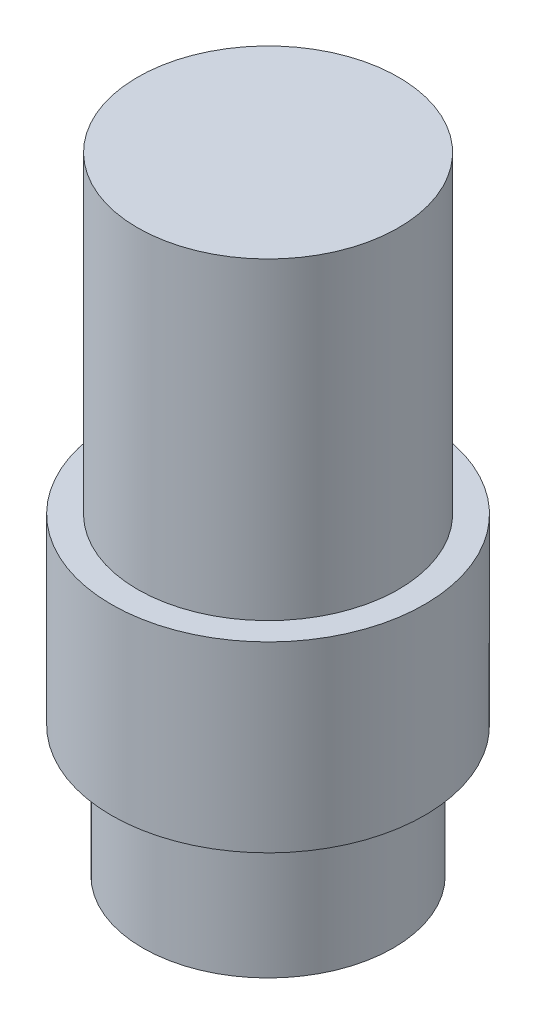
from build123d import *

# Parameters (mm, degrees)
SKETCH1_R           = 2.4
BOSS_EXTRUDE1_DEPTH = 2.5
SKETCH2_R           = 3
BOSS_EXTRUDE2_DEPTH = 3.5
SKETCH3_R           = 2.5
BOSS_EXTRUDE3_DEPTH = 6


with BuildPart() as part:
    # Sketch1 → Boss-Extrude1 (new body)
    with BuildSketch(Plane(origin=(0, 0, 0), x_dir=(1, 0, 0), z_dir=(0, 1, 0))):
        with Locations(Location((0, 0, 0), (0, 0, 270))):
            Circle(SKETCH1_R)
    extrude(amount=BOSS_EXTRUDE1_DEPTH)

    # Sketch2 → Boss-Extrude2 (add)
    with BuildSketch(Plane(origin=(0, 2.5, 0), x_dir=(1, 0, 0), z_dir=(0, 1, 0))):
        with Locations(Location((0, 0, 0), (0, 0, 270))):
            Circle(SKETCH2_R)
    extrude(amount=BOSS_EXTRUDE2_DEPTH)

    # Sketch3 → Boss-Extrude3 (add)
    with BuildSketch(Plane(origin=(0, 6, 0), x_dir=(1, 0, 0), z_dir=(0, 1, 0))):
        with Locations(Location((0, 0, 0), (0, 0, 270))):
            Circle(SKETCH3_R)
    extrude(amount=BOSS_EXTRUDE3_DEPTH)


solid = part.part
